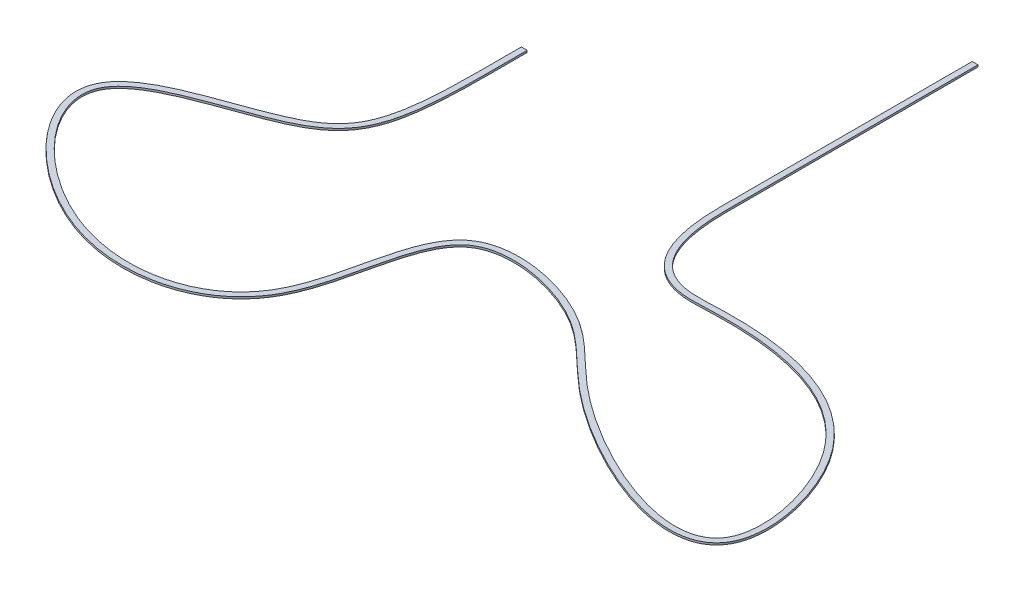
from build123d import *

# Parameters (mm, degrees)
BOSS_EXTRUDE3_DEPTH = 10


with BuildPart() as part:
    # Sketch1 → Boss-Extrude3 (new body)
    with BuildSketch(Plane(origin=(0, 0, 0), x_dir=(1, 0, 0), z_dir=(0, 1, 0))):
        with BuildLine():
            Line((-1800, 0), (-1800, -200))
            add(Edge.make_bspline(
                [(-1800, -200), (-1800, -543.775958973), (-1644.85776395, -709.700816726), (-1056.465753841, -667.760403918), (-390.715014947, -787.827323273), (-115.852661247, -2042.603655943), (-1266.951468872, -1497.626516548), (-1650.972616134, -1003.672403543), (-2504.987443379, -816.756429146), (-2411.234175575, -1892.362947517), (-3401.549405947, -2117.299330891), (-4308.065268926, -1186.376898904), (-3088.785171912, -965.527321936), (-3000, -658.386110554), (-3000, -200)],
                knots=[0, 0, 0, 0, 0.068089567, 0.085927657, 0.203459509, 0.276471939, 0.401964241, 0.455969173, 0.527914689, 0.623416847, 0.716393813, 0.819188822, 0.909166057, 1, 1, 1, 1], degree=3))
            Line((-3000, -200), (-3000, 0))
            Line((-3000, 0), (-3030, 0))
            Line((-3030, 0), (-3030, -200))
            add(Edge.make_bspline(
                [(-1770, -200), (-1770, -202.402726685), (-1769.98761895, -207.224491946), (-1769.913567367, -216.737336548), (-1769.729027424, -228.474147381), (-1769.361850128, -242.284652733), (-1768.67991446, -260.345781839), (-1767.470484405, -282.259565392), (-1765.460032994, -307.50908034), (-1762.902941841, -331.722987205), (-1758.781936519, -362.643523782), (-1752.329807549, -398.765721216), (-1742.619001879, -438.169198211), (-1731.060567657, -473.742739491), (-1717.780447536, -505.615714455), (-1697.940442845, -543.384264594), (-1669.43917741, -582.165052241), (-1629.872105663, -616.930624639), (-1592.314219888, -637.474865983), (-1559.334563298, -649.35589611), (-1533.12244128, -656.050035993), (-1505.446437219, -660.596707519), (-1476.357048345, -663.00033167), (-1445.45982628, -663.59885161), (-1413.132600648, -662.93369411), (-1385.197184725, -661.789097925), (-1362.383350774, -660.819948012), (-1345.047583315, -660.14328178), (-1327.593100519, -659.5984651), (-1304.272087323, -659.057585108), (-1274.996163582, -658.739624883), (-1239.723177183, -658.969581147), (-1192.55500008, -660.14226698), (-1133.445998412, -663.327883194), (-1062.617754137, -670.211613646), (-992.234696423, -680.46988905), (-922.641439478, -694.420768142), (-831.370487174, -718.375741991), (-721.017084364, -759.174762999), (-597.557567261, -828.133172733), (-504.84788261, -904.377483855), (-438.500486415, -977.718973597), (-393.039510754, -1039.161427489), (-352.390309535, -1107.128734841), (-317.127338875, -1179.625213421), (-287.700104096, -1254.903357088), (-264.657490326, -1331.166044217), (-248.575943032, -1406.661460196), (-240.088873901, -1479.687585616), (-239.930582836, -1548.629003831), (-247.525559019, -1601.435877099), (-258.960804034, -1640.141405077), (-268.557478326, -1662.661661593), (-277.838355607, -1679.509159004), (-288.250771316, -1695.515533611), (-303.227579333, -1713.571862757), (-324.01406084, -1731.974213975), (-354.952102158, -1752.088206051), (-398.643469016, -1769.154732999), (-457.011107668, -1778.414755527), (-520.373003956, -1778.14849527), (-588.06059385, -1769.579396214), (-683.143800982, -1748.358075327), (-809.130631112, -1705.539254529), (-964.711485155, -1634.09420716), (-1091.720234749, -1562.63600047), (-1187.873088526, -1501.164006356), (-1256.292635281, -1453.603293778), (-1309.411686032, -1413.343367456), (-1349.115952661, -1381.064301019), (-1377.308574032, -1356.976367672), (-1404.101661038, -1333.126623389), (-1438.273844281, -1301.720553755), (-1478.638827683, -1263.378789552), (-1525.138239409, -1219.329086184), (-1571.528634803, -1177.653963464), (-1611.642691726, -1145.162680598), (-1645.568246067, -1120.623382216), (-1672.180100067, -1102.96511618), (-1700.211494252, -1086.088905416), (-1729.951803124, -1069.958591765), (-1761.136038857, -1054.698061816), (-1804.339344814, -1035.668683307), (-1860.801175147, -1014.640780341), (-1930.62363706, -994.698759186), (-2000.634868499, -980.879053648), (-2068.924965137, -973.960416535), (-2133.542854009, -974.635212353), (-2182.675504623, -981.97676893), (-2218.209028464, -992.055597619), (-2242.775036257, -1001.724419983), (-2261.372261911, -1011.537501418), (-2275.085393706, -1020.462600961), (-2288.204148047, -1030.198015753), (-2303.528670681, -1043.848281989), (-2326.051156872, -1068.842100206), (-2350.806497801, -1105.905978154), (-2375.843551318, -1158.804473032), (-2397.016599756, -1218.708859425), (-2415.353426268, -1284.064956469), (-2437.600998888, -1376.411624458), (-2459.076743837, -1473.537377588), (-2485.265278324, -1569.725928149), (-2504.828066128, -1628.318955023), (-2523.168332599, -1673.588422883), (-2538.47690065, -1706.56190142), (-2555.533511242, -1738.364639367), (-2574.602802898, -1768.822059656), (-2595.609815098, -1797.528651551), (-2626.03502171, -1833.468960778), (-2668.366927617, -1873.941335013), (-2725.245003838, -1915.254165508), (-2808.157415157, -1960.56234264), (-2923.187610401, -1998.761348983), (-3048.769634567, -2012.20366296), (-3152.952690887, -2007.945307708), (-3232.30478941, -1997.187682361), (-3298.907586805, -1981.863997844), (-3352.150923197, -1965.759089428), (-3405.265157499, -1947.058823254), (-3470.957987828, -1919.076888432), (-3547.749880155, -1879.101223759), (-3621.530784363, -1833.651023529), (-3714.589194342, -1766.958760767), (-3797.701879907, -1692.918173477), (-3866.876552044, -1614.898584229), (-3910.76909212, -1555.153227657), (-3945.615524596, -1494.860547128), (-3970.249218243, -1434.587735133), (-3981.080908549, -1384.75673749), (-3982.966667325, -1345.473647588), (-3980.704032467, -1316.476011524), (-3975.52712625, -1292.910496169), (-3969.312424345, -1274.593919533), (-3961.6852353, -1256.700985477), (-3949.732248749, -1235.525019611), (-3926.118450853, -1204.073938731), (-3889.316788339, -1168.975726539), (-3836.006955007, -1132.001520551), (-3775.371768717, -1098.856295417), (-3709.141814278, -1068.571491679), (-3639.072525945, -1040.368767325), (-3566.973859751, -1013.574333797), (-3494.70503097, -987.57310658), (-3424.172766099, -961.792286148), (-3368.470740793, -940.0480033), (-3326.767234597, -922.266159264), (-3297.170280169, -908.686773964), (-3269.554115779, -894.840403096), (-3235.527990028, -875.916153703), (-3197.961287771, -851.116250208), (-3160.125925611, -818.701202857), (-3128.574499921, -782.579038729), (-3102.350010271, -741.368378303), (-3080.764934485, -693.52693385), (-3063.43357501, -637.660079415), (-3052.31151555, -583.467747888), (-3045.256837842, -535.049982743), (-3040.842949694, -496.092499685), (-3037.258981199, -454.379166511), (-3034.453932865, -409.799220316), (-3032.72071491, -370.167689688), (-3031.66872718, -336.917392671), (-3031.039848963, -311.193001275), (-3030.563841897, -284.667648803), (-3030.288456493, -261.884067125), (-3030.137224242, -243.241965806), (-3030.057407949, -229.052437646), (-3030.018124008, -217.048041202), (-3030.00256679, -207.34698328), (-3030, -202.444680262), (-3030, -200)],
                knots=[0, 0, 0, 0, 0.000488281, 0.000976562, 0.001953125, 0.002929688, 0.00390625, 0.005859375, 0.0078125, 0.009765625, 0.01171875, 0.015625, 0.01953125, 0.0234375, 0.02734375, 0.03125, 0.0390625, 0.046875, 0.0546875, 0.05859375, 0.0625, 0.06640625, 0.0703125, 0.07421875, 0.078125, 0.08203125, 0.083984375, 0.0859375, 0.087890625, 0.08984375, 0.09375, 0.09765625, 0.1015625, 0.109375, 0.1171875, 0.125, 0.1328125, 0.140625, 0.15625, 0.171875, 0.1875, 0.1953125, 0.203125, 0.2109375, 0.21875, 0.2265625, 0.234375, 0.2421875, 0.25, 0.2578125, 0.265625, 0.26953125, 0.2734375, 0.275390625, 0.27734375, 0.28125, 0.28515625, 0.2890625, 0.296875, 0.3046875, 0.3125, 0.3203125, 0.328125, 0.34375, 0.359375, 0.375, 0.3828125, 0.390625, 0.3984375, 0.40234375, 0.40625, 0.41015625, 0.4140625, 0.421875, 0.4296875, 0.4375, 0.4453125, 0.44921875, 0.453125, 0.45703125, 0.4609375, 0.46484375, 0.46875, 0.4765625, 0.484375, 0.4921875, 0.5, 0.5078125, 0.515625, 0.51953125, 0.5234375, 0.52734375, 0.529296875, 0.53125, 0.53515625, 0.5390625, 0.546875, 0.5546875, 0.5625, 0.5703125, 0.578125, 0.59375, 0.6015625, 0.609375, 0.61328125, 0.6171875, 0.62109375, 0.625, 0.62890625, 0.6328125, 0.640625, 0.6484375, 0.65625, 0.671875, 0.6875, 0.6953125, 0.703125, 0.7109375, 0.71484375, 0.71875, 0.7265625, 0.734375, 0.7421875, 0.75, 0.765625, 0.7734375, 0.78125, 0.7890625, 0.796875, 0.8046875, 0.80859375, 0.8125, 0.81640625, 0.818359375, 0.8203125, 0.82421875, 0.828125, 0.8359375, 0.84375, 0.8515625, 0.859375, 0.8671875, 0.875, 0.8828125, 0.890625, 0.8984375, 0.90234375, 0.90625, 0.91015625, 0.9140625, 0.921875, 0.9296875, 0.9375, 0.9453125, 0.953125, 0.9609375, 0.96875, 0.97265625, 0.9765625, 0.98046875, 0.984375, 0.98828125, 0.990234375, 0.9921875, 0.994140625, 0.99609375, 0.997070312, 0.998046875, 0.999023438, 0.999511719, 1, 1, 1, 1], degree=3))
            Line((-1770, -200), (-1770, 0))
            Line((-1770, 0), (-1770, 1100))
            Line((-1770, 1100), (-1800, 1100))
            Line((-1800, 1100), (-1800, 0))
        make_face()
    extrude(amount=BOSS_EXTRUDE3_DEPTH)


solid = part.part
